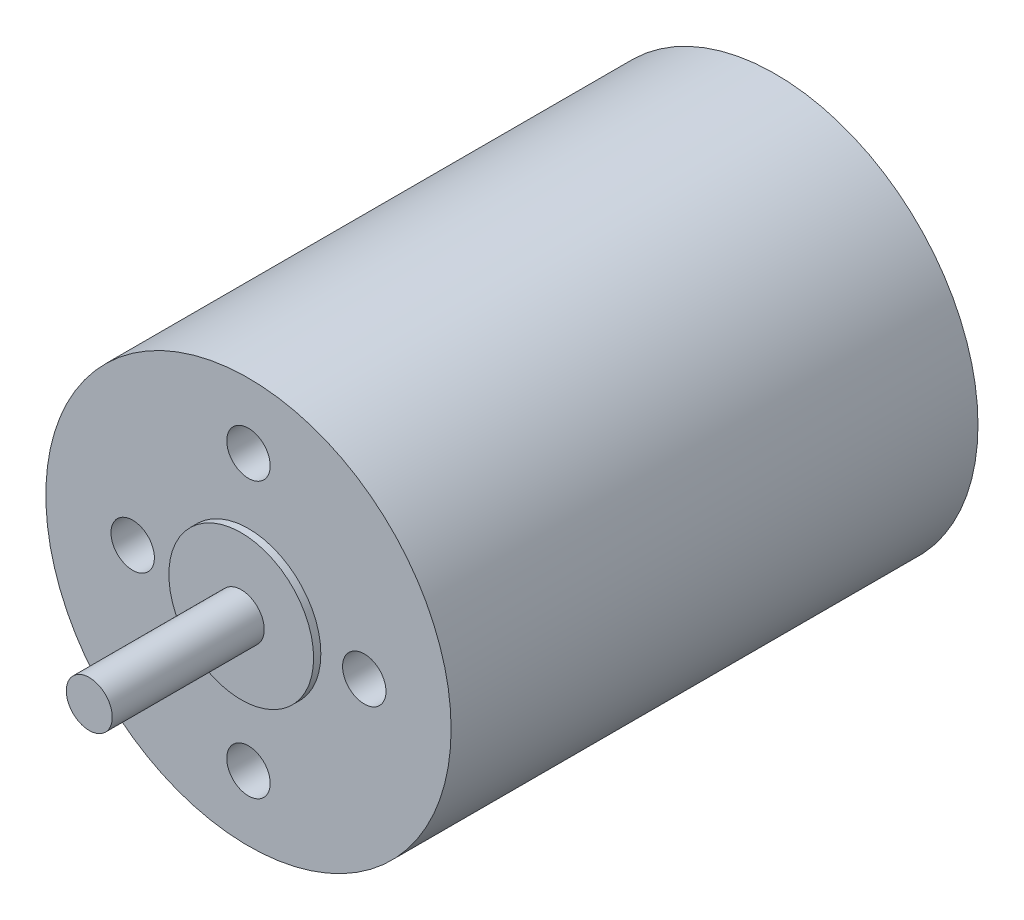
from build123d import *

# Parameters (mm, degrees)
SKETCH1_R                    = 14
BOSS_EXTRUDE1_DEPTH          = 36.4
SKETCH2_R                    = 5
BOSS_EXTRUDE2_DEPTH          = 0.5
SKETCH3_R                    = 1.5875
BOSS_EXTRUDE3_DEPTH          = 10.5
F_3_0_3_DIAMETER_HOLE1_D     = 3
F_3_0_3_DIAMETER_HOLE1_DEPTH = 4
F_3_0_3_DIAMETER_HOLE1_TIP   = 0.901290929


with BuildPart() as part:
    # Sketch1 → Boss-Extrude1 (new body)
    with BuildSketch(Plane.XY):
        Circle(SKETCH1_R)
    extrude(amount=BOSS_EXTRUDE1_DEPTH)

    # Sketch2 → Boss-Extrude2 (add)
    with BuildSketch(Plane.XY.offset(36.4)):
        Circle(SKETCH2_R)
    extrude(amount=BOSS_EXTRUDE2_DEPTH)

    # Sketch3 → Boss-Extrude3 (add)
    with BuildSketch(Plane.XY.offset(36.9)):
        with Locations(Location((0, 0, 0), (0, 0, 180))):
            Circle(SKETCH3_R)
    extrude(amount=BOSS_EXTRUDE3_DEPTH)

    # Ø3.0 (3) Diameter Hole1
    with Locations(Plane.XY.offset(36.4)):
        with Locations((0, 9.5), (0, -9.5), (8, 0), (-8, 0)):
            Hole(F_3_0_3_DIAMETER_HOLE1_D / 2, depth=F_3_0_3_DIAMETER_HOLE1_DEPTH)
            with Locations((0, 0, -(F_3_0_3_DIAMETER_HOLE1_DEPTH + F_3_0_3_DIAMETER_HOLE1_TIP / 2))):  # 118° drill point
                Cone(0, F_3_0_3_DIAMETER_HOLE1_D / 2, F_3_0_3_DIAMETER_HOLE1_TIP, mode=Mode.SUBTRACT)


solid = part.part
